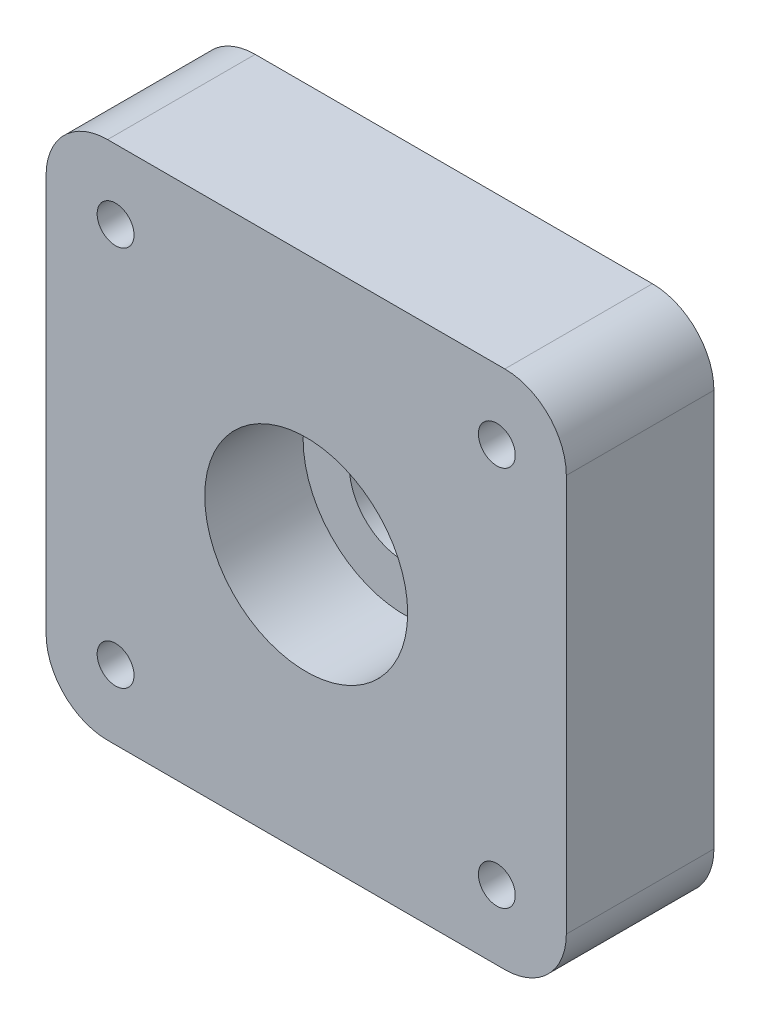
from build123d import *

# Parameters (mm, degrees)
CROQUIS1_W              = 42.3
CROQUIS1_H              = 42.3
CROQUIS1_R              = 1.5
SALIENTE_EXTRUIR1_DEPTH = 6
REDONDEO1_R             = 5
CROQUIS2_R              = 8.25
CORTAR_EXTRUIR1_DEPTH   = 8
CROQUIS3_R              = 4.5
CORTAR_EXTRUIR2_DEPTH   = 10


with BuildPart() as part:
    # Croquis1 → Saliente-Extruir1 (new, symmetric)
    with BuildSketch(Plane.XY):
        Rectangle(CROQUIS1_W, CROQUIS1_H)
        with Locations((-15.5, 15.5)):
            Circle(CROQUIS1_R, mode=Mode.SUBTRACT)
        with Locations((-15.5, -15.5)):
            Circle(CROQUIS1_R, mode=Mode.SUBTRACT)
        with Locations(Location((15.5, -15.5, 0), (0, 0, 180))):
            Circle(CROQUIS1_R, mode=Mode.SUBTRACT)
        with Locations(Location((15.5, 15.5, 0), (0, 0, 180))):
            Circle(CROQUIS1_R, mode=Mode.SUBTRACT)
    extrude(amount=SALIENTE_EXTRUIR1_DEPTH, both=True)

    # Redondeo1
    redondeo1_edges = [part.edges().sort_by_distance(p)[0] for p in [
        (21.15, -21.15, 0),
        (-21.15, -21.15, 0),
        (-21.15, 21.15, 0),
        (21.15, 21.15, 0),
    ]]
    fillet(redondeo1_edges, radius=REDONDEO1_R)

    # Croquis2 → Cortar-Extruir1 (cut)
    with BuildSketch(Plane.XY.offset(6)):
        Circle(CROQUIS2_R)
    extrude(amount=-CORTAR_EXTRUIR1_DEPTH, mode=Mode.SUBTRACT)

    # Croquis3 → Cortar-Extruir2 (cut)
    with BuildSketch(Plane(origin=(0, 0, -6), x_dir=(-1, 0, 0), z_dir=(0, 0, -1))):
        Circle(CROQUIS3_R)
    extrude(amount=-CORTAR_EXTRUIR2_DEPTH, mode=Mode.SUBTRACT)


solid = part.part
